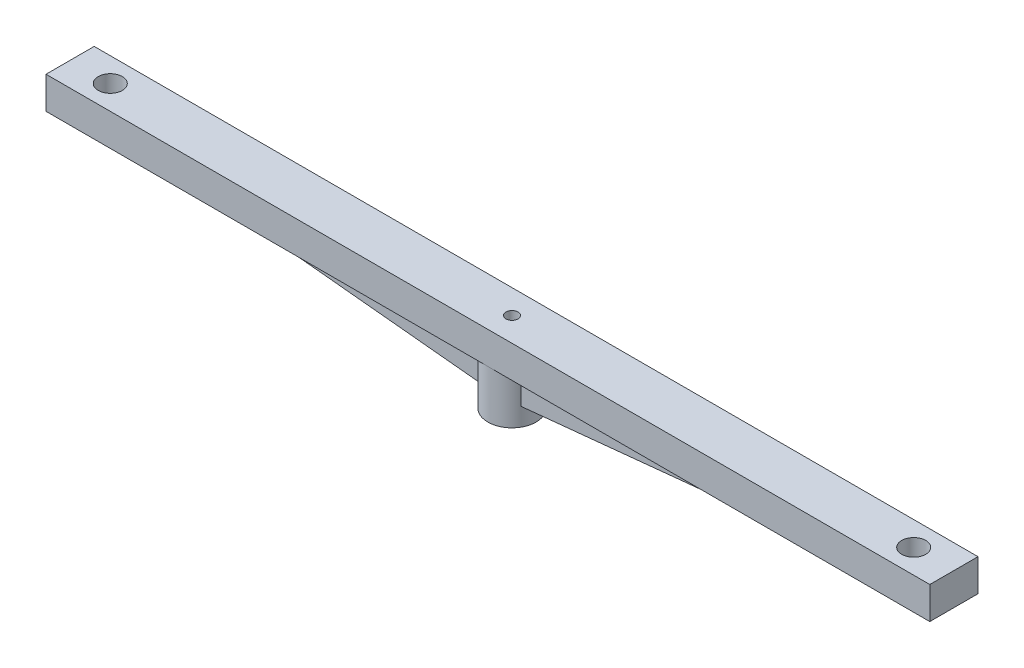
from build123d import *

# Parameters (mm, degrees)
SKETCH1_W                  = 110
SKETCH1_H                  = 4
BOSS_EXTRUDE1_DEPTH        = 3
BOSS_EXTRUDE2_DEPTH        = 1.5
F_3_0_3_DIAMETER_HOLE1_D   = 3
SKETCH5_R                  = 3
BOSS_EXTRUDE3_DEPTH        = 6
F_1_5_1_5_DIAMETER_HOLE1_D = 1.5
SKETCH8_R                  = 2
CUT_EXTRUDE1_DEPTH         = 6


with BuildPart() as part:
    # Sketch1 → Boss-Extrude1 (new, symmetric)
    with BuildSketch(Plane.XY):
        Rectangle(SKETCH1_W, SKETCH1_H)
    extrude(amount=BOSS_EXTRUDE1_DEPTH, both=True)

    # Sketch2 → Boss-Extrude2 (add, symmetric)
    with BuildSketch(Plane.XY):
        Polygon((-40, -2), (0, -6), (40, -2), align=None)
    extrude(amount=BOSS_EXTRUDE2_DEPTH, both=True)

    # Ø3.0 (3) Diameter Hole1 (through all)
    with Locations(Plane(origin=(0, 2, 0), x_dir=(1, 0, 0), z_dir=(0, 1, 0))):
        with Locations((-50, 0), (50, 0)):
            Hole(F_3_0_3_DIAMETER_HOLE1_D / 2)

    # Sketch5 → Boss-Extrude3 (add)
    with BuildSketch(Plane.XZ.offset(2)):
        with Locations(Location((0, 0, 0), (0, 0, 150))):
            Circle(SKETCH5_R)
    extrude(amount=BOSS_EXTRUDE3_DEPTH)

    # Ø1.5 (1.5) Diameter Hole1 (through all)
    with Locations(Plane(origin=(0, -8, 0), x_dir=(-1, 0, 0), z_dir=(0, -1, 0))):
        with Locations((0, 0)):
            Hole(F_1_5_1_5_DIAMETER_HOLE1_D / 2)

    # Sketch8 → Cut-Extrude1 (cut)
    with BuildSketch(Plane.XZ.offset(8)):
        Circle(SKETCH8_R)
    extrude(amount=-CUT_EXTRUDE1_DEPTH, mode=Mode.SUBTRACT)


solid = part.part
